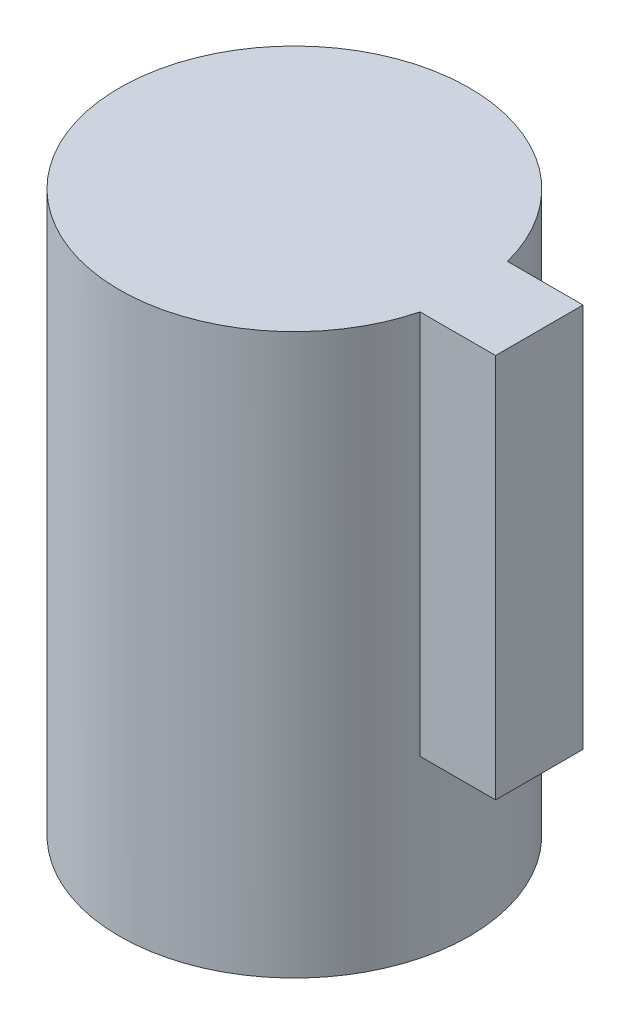
from build123d import *

# Parameters (mm, degrees)
SKETCH1_R           = 5
BOSS_EXTRUDE1_DEPTH = 8
SKETCH2_W           = 7
SKETCH2_H           = 2.5
BOSS_EXTRUDE2_DEPTH = 11


with BuildPart() as part:
    # Sketch1 → Boss-Extrude1 (new, symmetric)
    with BuildSketch(Plane(origin=(0, 0, 0), x_dir=(1, 0, 0), z_dir=(0, 1, 0))):
        with Locations(Location((0, 0, 0), (0, 0, 270))):
            Circle(SKETCH1_R)
    extrude(amount=BOSS_EXTRUDE1_DEPTH, both=True)

    # Sketch2 → Boss-Extrude2 (add)
    with BuildSketch(Plane(origin=(0, 8, 0), x_dir=(1, 0, 0), z_dir=(0, 1, 0))):
        with Locations((3.5, 0)):
            Rectangle(SKETCH2_W, SKETCH2_H)
    extrude(amount=-BOSS_EXTRUDE2_DEPTH)


solid = part.part
